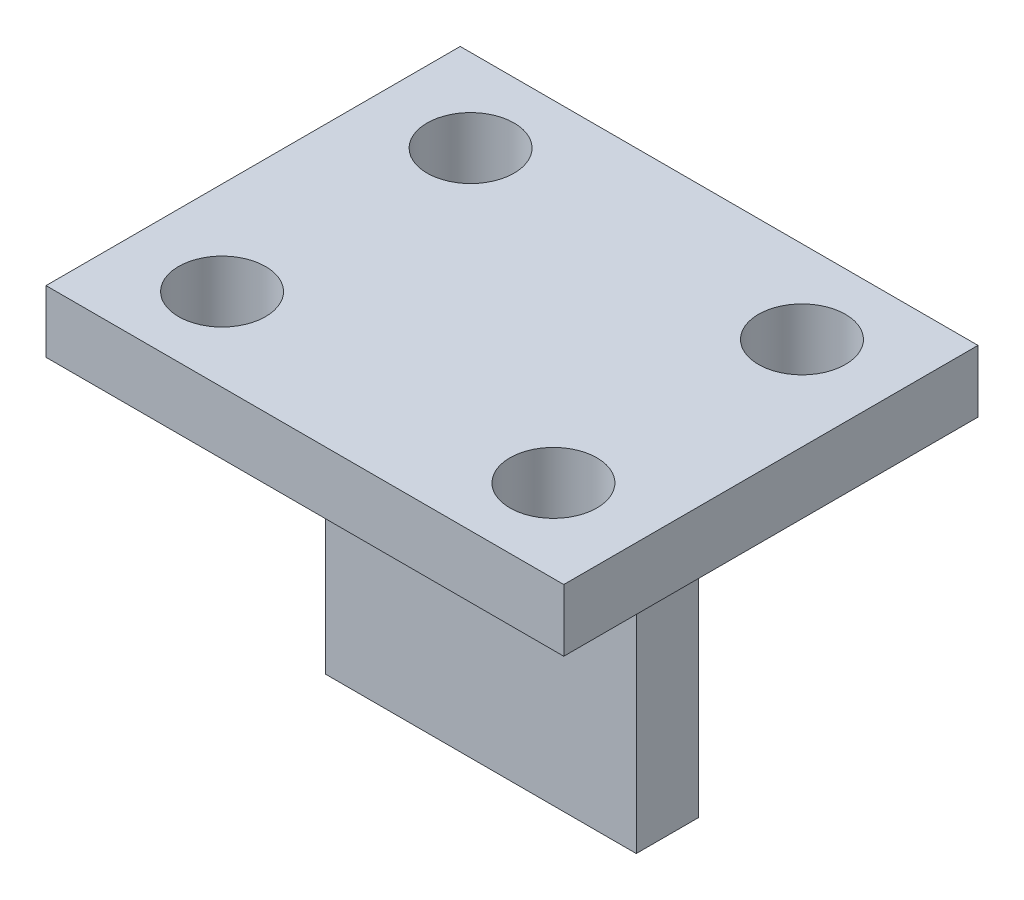
from build123d import *

# Parameters (mm, degrees)
SKETCH1_W                      = 25
SKETCH1_H                      = 20
BOSS_EXTRUDE1_DEPTH            = 1.5
SKETCH2_W                      = 15
SKETCH2_H                      = 3
BOSS_EXTRUDE2_DEPTH            = 15
CUT_EXTRUDE1_REACH             = 26.088
SKETCH3_R                      = 2.1
CUT_EXTRUDE1_DIRECTION_2_DEPTH = 25.088378941


with BuildPart() as part:
    # Sketch1 → Boss-Extrude1 (new, symmetric)
    with BuildSketch(Plane(origin=(0, 0, 0), x_dir=(1, 0, 0), z_dir=(0, 1, 0))):
        Rectangle(SKETCH1_W, SKETCH1_H)
    extrude(amount=BOSS_EXTRUDE1_DEPTH, both=True)

    # Sketch2 → Boss-Extrude2 (add)
    with BuildSketch(Plane.XZ.offset(1.5)):
        Rectangle(SKETCH2_W, SKETCH2_H)
    extrude(amount=BOSS_EXTRUDE2_DEPTH)

    # Sketch3 → Cut-Extrude1 (cut, up to next)
    with BuildSketch(Plane(origin=(0, 1.5, 0), x_dir=(1, 0, 0), z_dir=(0, 1, 0)), mode=Mode.PRIVATE) as cut_extrude1_sk1:
        with Locations(Location((-8, 6, 0), (0, 0, 90))):
            Circle(SKETCH3_R)
    cut_extrude1_tool1 = extrude(cut_extrude1_sk1.sketch, amount=-CUT_EXTRUDE1_REACH, mode=Mode.PRIVATE) & part.part
    # Sketch3 → Cut-Extrude1 (cut, up to next)
    with BuildSketch(Plane(origin=(0, 1.5, 0), x_dir=(1, 0, 0), z_dir=(0, 1, 0)), mode=Mode.PRIVATE) as cut_extrude1_sk2:
        with Locations(Location((8, 6, 0), (0, 0, 90))):
            Circle(SKETCH3_R)
    cut_extrude1_tool2 = extrude(cut_extrude1_sk2.sketch, amount=-CUT_EXTRUDE1_REACH, mode=Mode.PRIVATE) & part.part
    # Sketch3 → Cut-Extrude1 (cut, up to next)
    with BuildSketch(Plane(origin=(0, 1.5, 0), x_dir=(1, 0, 0), z_dir=(0, 1, 0)), mode=Mode.PRIVATE) as cut_extrude1_sk3:
        with Locations(Location((8, -6, 0), (0, 0, 90))):
            Circle(SKETCH3_R)
    cut_extrude1_tool3 = extrude(cut_extrude1_sk3.sketch, amount=-CUT_EXTRUDE1_REACH, mode=Mode.PRIVATE) & part.part
    # Sketch3 → Cut-Extrude1 (cut, up to next)
    with BuildSketch(Plane(origin=(0, 1.5, 0), x_dir=(1, 0, 0), z_dir=(0, 1, 0)), mode=Mode.PRIVATE) as cut_extrude1_sk4:
        with Locations(Location((-8, -6, 0), (0, 0, 90))):
            Circle(SKETCH3_R)
    cut_extrude1_tool4 = extrude(cut_extrude1_sk4.sketch, amount=-CUT_EXTRUDE1_REACH, mode=Mode.PRIVATE) & part.part
    add(cut_extrude1_tool1.solids().sort_by_distance((-8, 1.5, -6))[0], mode=Mode.SUBTRACT)
    add(cut_extrude1_tool2.solids().sort_by_distance((8, 1.5, -6))[0], mode=Mode.SUBTRACT)
    add(cut_extrude1_tool3.solids().sort_by_distance((8, 1.5, 6))[0], mode=Mode.SUBTRACT)
    add(cut_extrude1_tool4.solids().sort_by_distance((-8, 1.5, 6))[0], mode=Mode.SUBTRACT)

    # Sketch3 → Cut-Extrude1 direction 2 (cut)
    with BuildSketch(Plane(origin=(0, 1.5, 0), x_dir=(1, 0, 0), z_dir=(0, 1, 0))):
        with Locations(Location((-8, 6, 0), (0, 0, 90))):
            Circle(SKETCH3_R)
        with Locations(Location((8, 6, 0), (0, 0, 90))):
            Circle(SKETCH3_R)
        with Locations(Location((8, -6, 0), (0, 0, 90))):
            Circle(SKETCH3_R)
        with Locations(Location((-8, -6, 0), (0, 0, 90))):
            Circle(SKETCH3_R)
    extrude(amount=CUT_EXTRUDE1_DIRECTION_2_DEPTH, mode=Mode.SUBTRACT)


solid = part.part
